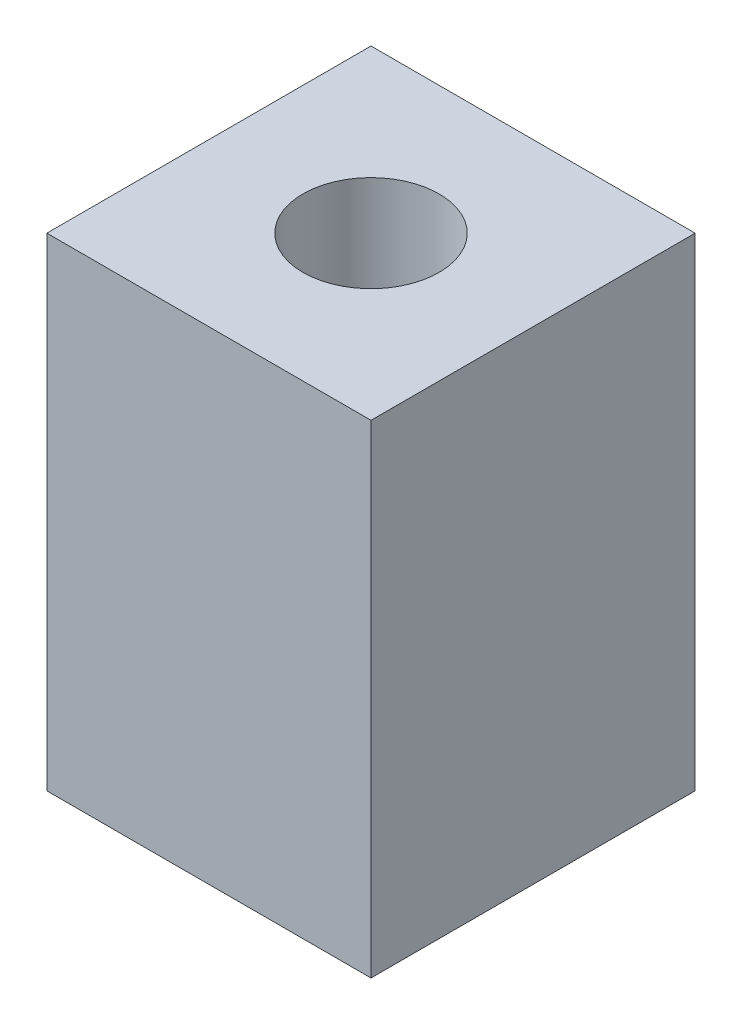
from build123d import *

# Parameters (mm, degrees)
SKETCH_1_W      = 10
SKETCH_1_H      = 10
SKETCH_1_R      = 2.1
EXTRUDE_1_DEPTH = 14.9


with BuildPart() as part:
    # Эскиз1 → Бобышка-Вытянуть1 (new body)
    with BuildSketch(Plane(origin=(0, 0, 0), x_dir=(1, 0, 0), z_dir=(0, 1, 0))):
        Rectangle(SKETCH_1_W, SKETCH_1_H)
        with Locations(Location((0, 0, 0), (0, 0, 270))):
            Circle(SKETCH_1_R, mode=Mode.SUBTRACT)
    extrude(amount=EXTRUDE_1_DEPTH)


solid = part.part
